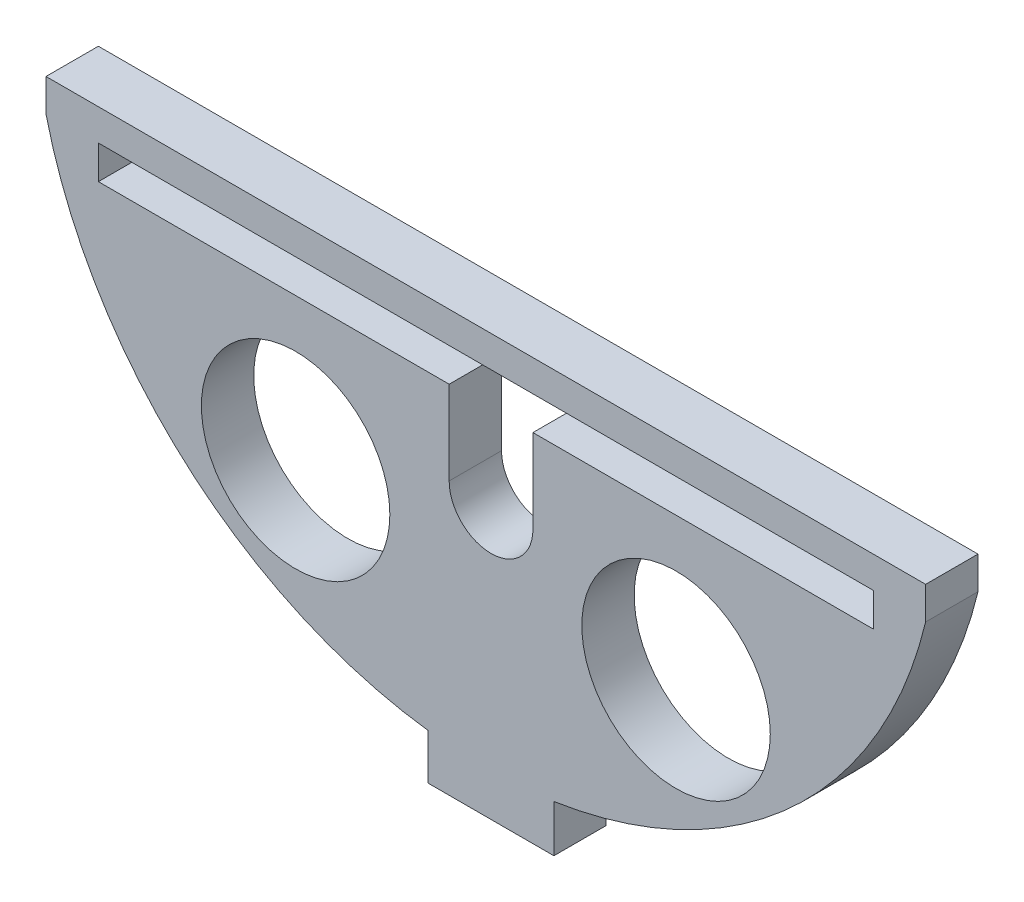
from build123d import *

# Parameters (mm, degrees)
SALIENTE_EXTRUIR1_DEPTH = 5
CROQUIS3_R              = 9
SALIENTE_EXTRUIR2_DEPTH = 5


with BuildPart() as part:
    # Croquis1 → Saliente-Extruir1 (new body)
    with BuildSketch(Plane.XY):
        with BuildLine():
            Line((42, 4.6), (-42, 4.6))
            Line((-42, 4.6), (-42, 1.488620272))
            ThreePointArc((-42, 1.488620272), (-41.136537684, -1.59186368), (-40.04747183, -4.6))
            Line((-40.04747183, -4.6), (-5.5, -4.6))
            Line((-5.5, -4.6), (-5.5, -9.6))
            ThreePointArc((-5.5, -9.6), (0.5, -15.6), (6.5, -9.6))
            Line((6.5, -9.6), (6.5, -4.6))
            Line((6.5, -4.6), (40.04747183, -4.6))
            ThreePointArc((40.04747183, -4.6), (41.136537684, -1.59186368), (42, 1.488620272))
            Line((42, 1.488620272), (42, 4.6))
        make_face()
        with BuildLine():
            Line((-3.5, -1.6), (-37, -1.6))
            Line((-37, -1.6), (-37, 1.6))
            Line((-37, 1.6), (37, 1.6))
            Line((37, 1.6), (37, -1.6))
            Line((37, -1.6), (4.5, -1.6))
            Line((4.5, -1.6), (4.5, -4.6))
            Line((4.5, -4.6), (4.5, -5.127864045))
            Line((4.5, -5.127864045), (4.5, -8.163859338))
            Line((4.5, -8.163859338), (4.5, -9.6))
            ThreePointArc((4.5, -9.6), (0.5, -13.6), (-3.5, -9.6))
            Line((-3.5, -9.6), (-3.5, -8.163859338))
            Line((-3.5, -8.163859338), (-3.5, -5.127864045))
            Line((-3.5, -5.127864045), (-3.5, -4.6))
            Line((-3.5, -4.6), (-3.5, -1.6))
        make_face(mode=Mode.SUBTRACT)
    extrude(amount=SALIENTE_EXTRUIR1_DEPTH)

    # Croquis3 → Saliente-Extruir2 (add)
    with BuildSketch(Plane.XY):
        with BuildLine():
            Line((6.5, -4.6), (40.04747183, -4.6))
            ThreePointArc((40.04747183, -4.6), (26.783164421, -22.295458451), (6.5, -31.108195935))
            Line((6.5, -31.108195935), (6.5, -35.6))
            Line((6.5, -35.6), (-5.5, -35.6))
            Line((-5.5, -35.6), (-5.5, -31.248453881))
            ThreePointArc((-5.5, -31.248453881), (-9.599739244, -30.51988849), (-13.610290225, -29.4))
            ThreePointArc((-13.610290225, -29.4), (-29.555859947, -19.907001489), (-40.04747183, -4.6))
            Line((-40.04747183, -4.6), (-5.5, -4.6))
            Line((-5.5, -4.6), (-5.5, -9.6))
            ThreePointArc((-5.5, -9.6), (0.5, -15.6), (6.5, -9.6))
            Line((6.5, -9.6), (6.5, -4.6))
        make_face()
        with Locations((-18.164580145, -15.2118728)):
            Circle(CROQUIS3_R, mode=Mode.SUBTRACT)
        with Locations((18.164580145, -15.2118728)):
            Circle(CROQUIS3_R, mode=Mode.SUBTRACT)
    extrude(amount=SALIENTE_EXTRUIR2_DEPTH)


solid = part.part
